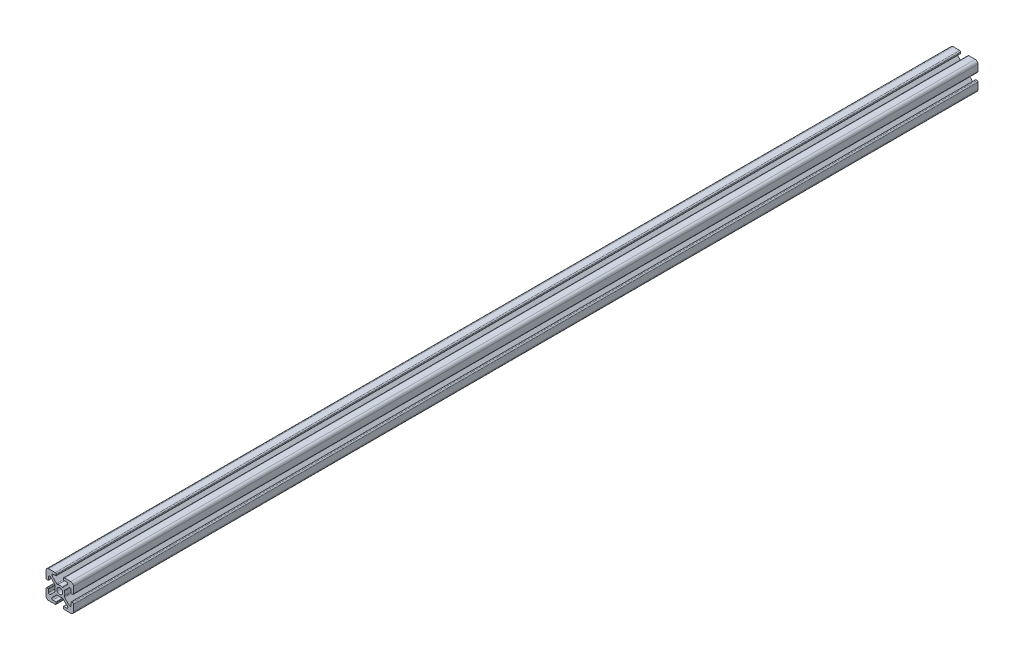
from build123d import *

# Parameters (mm, degrees)
BOSS_EXTRUDE1_DEPTH = 657
CIRPATTERN1_COUNT   = 4


with BuildPart() as part:
    # Sketch2 → Boss-Extrude1 (new body)
    with BuildSketch(Plane.XY):
        with BuildLine():
            Line((-5.045621395, 8.2), (-2.825, 8.2))
            ThreePointArc((-2.825, 8.2), (-2.648223305, 8.273223305), (-2.575, 8.45))
            Line((-2.575, 8.45), (-2.575, 9.220621395))
            ThreePointArc((-2.575, 9.220621395), (-2.803274708, 9.771725292), (-3.354378605, 10))
            Line((-3.354378605, 10), (-8, 10))
            ThreePointArc((-8, 10), (-9.414213562, 9.414213562), (-10, 8))
            Line((-10, 8), (-10, 3.354378605))
            ThreePointArc((-10, 3.354378605), (-9.771725292, 2.803274708), (-9.220621395, 2.575))
            Line((-9.220621395, 2.575), (-8.45, 2.575))
            ThreePointArc((-8.45, 2.575), (-8.273223305, 2.648223305), (-8.2, 2.825))
            Line((-8.2, 2.825), (-8.2, 5.045621395))
            ThreePointArc((-8.2, 5.045621395), (-7.718876674, 5.765673336), (-6.869517498, 5.596725292))
            Line((-6.869517498, 5.596725292), (-3.534592295, 2.261800088))
            ThreePointArc((-3.534592295, 2.261800088), (-3.321003619, 1.861282645), (-3.366790791, 1.409687827))
            ThreePointArc((-3.366790791, 1.409687827), (-3.578497337, 0.718927539), (-3.65, 0))
            Line((-3.65, 0), (-2.15, 0))
            ThreePointArc((-2.15, 0), (-1.52027958, 1.52027958), (0, 2.15))
            Line((0, 2.15), (0, 3.65))
            ThreePointArc((0, 3.65), (-0.718927539, 3.578497337), (-1.409687827, 3.366790791))
            ThreePointArc((-1.409687827, 3.366790791), (-1.861282645, 3.321003619), (-2.261800088, 3.534592295))
            Line((-2.261800088, 3.534592295), (-5.596725292, 6.869517498))
            ThreePointArc((-5.596725292, 6.869517498), (-5.765673336, 7.718876674), (-5.045621395, 8.2))
        make_face()
    boss_extrude1 = extrude(amount=BOSS_EXTRUDE1_DEPTH)

    # CirPattern1: Boss-Extrude1 ×4 about axis
    cirpattern1_axis = Axis((0, 0, 657), (0, 0, -1))
    for i in range(1, CIRPATTERN1_COUNT):
        add(boss_extrude1.rotate(cirpattern1_axis, i * 360 / CIRPATTERN1_COUNT))


solid = part.part
